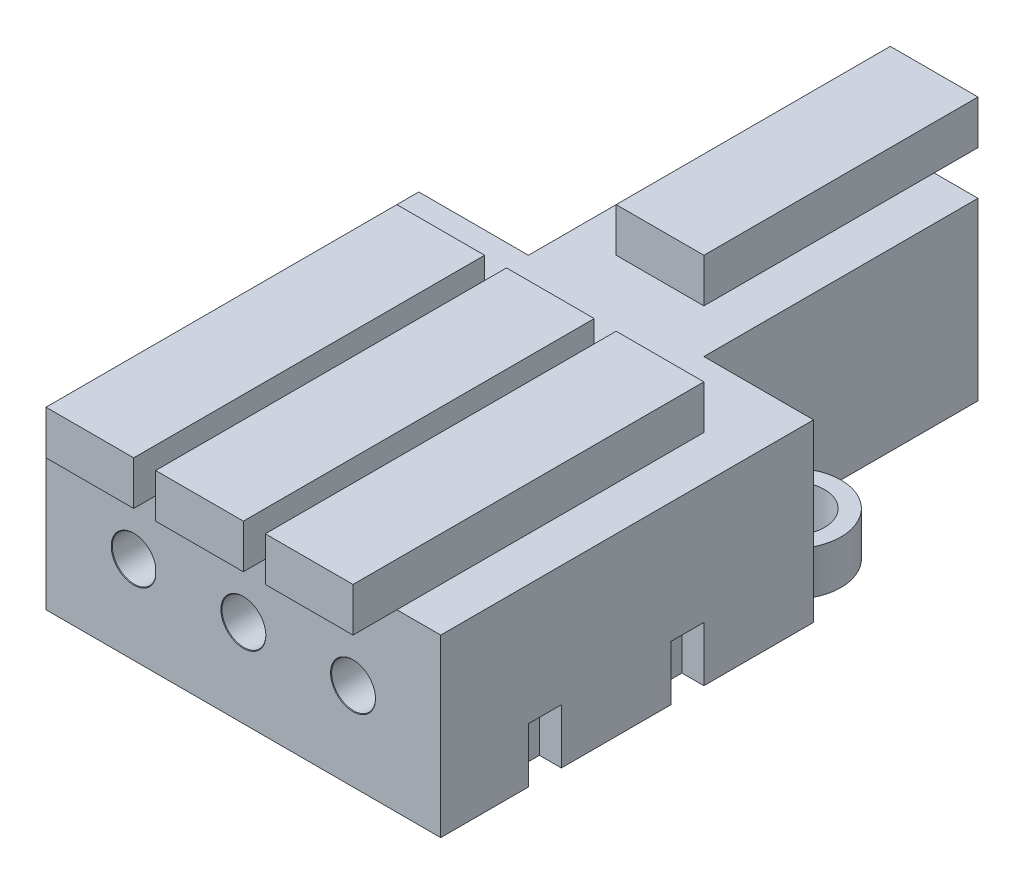
from build123d import *

# Parameters (mm, degrees)
SKETCH1_W                  = 8
SKETCH1_H                  = 17
CONNECTOR_BODY_DEPTH       = 8
SKETCH4_W                  = 4
SKETCH4_H                  = 16
CLAMP_DEPTH                = 2
CONNECTOR_PATTERN_COUNT    = 3
CONNECTOR_PATTERN_PITCH    = 5
SKETCH5_W                  = 8
SKETCH5_H                  = 12.5
SINGLE_BODY_DEPTH          = 8
SKETCH6_W                  = 1.5
SKETCH6_H                  = 2.500390225
CHAINING_NOBS_DEPTH        = 1
SKETCH7_W                  = 1
SKETCH7_H                  = 1.5
CHAINING_NOBS_CUTOUT_DEPTH = 2.50039
SKETCH8_W                  = 4
SKETCH8_H                  = 12.5
SINGLE_BODY_CLAMP_DEPTH    = 2
SKETCH9_R                  = 2.25
SKETCH9_R_2                = 1.5
MOUNTING_RINGS_DEPTH       = 2


with BuildPart() as part:
    # Sketch1 → connector_body (new body)
    with BuildSketch(Plane(origin=(0, 0, 0), x_dir=(1, 0, 0), z_dir=(0, 1, 0))):
        with Locations((4, 8.5)):
            Rectangle(SKETCH1_W, SKETCH1_H)
    connector_body = extrude(amount=CONNECTOR_BODY_DEPTH)

    # Sketch3 → cable_hole (revolve, cut)
    with BuildSketch(Plane(origin=(4, 4, 0), x_dir=(0, -1, 0), z_dir=(1, 0, 0))):
        Polygon((0, 0), (0, 10.600860619), (1, 10), (1, 0.025), (1.025, 0), align=None)
    cable_hole = revolve(axis=Axis((4, 4, 6.35), (0, 0, -1)), mode=Mode.SUBTRACT)

    # Sketch4 → clamp (add)
    with BuildSketch(Plane(origin=(0, 8, 0), x_dir=(1, 0, 0), z_dir=(0, 1, 0))):
        with Locations((4, 6)):
            Rectangle(SKETCH4_W, SKETCH4_H)
    clamp = extrude(amount=CLAMP_DEPTH)

    # connector_pattern: connector_body, cable_hole, clamp ×3
    with Locations(*[(i * CONNECTOR_PATTERN_PITCH, 0, 0) for i in range(1, CONNECTOR_PATTERN_COUNT)]):
        add(connector_body)
        add(cable_hole, mode=Mode.SUBTRACT)
        add(clamp)

    # Sketch5 → single_body (add)
    with BuildSketch(Plane(origin=(0, 8, 0), x_dir=(1, 0, 0), z_dir=(0, 1, 0))):
        with Locations((9, 23.25)):
            Rectangle(SKETCH5_W, SKETCH5_H)
    extrude(amount=-SINGLE_BODY_DEPTH)

    # Sketch6 → chaining_nobs (add)
    with BuildSketch(Plane.ZY):
        with Locations((-11.25, 1.250195113)):
            Rectangle(SKETCH6_W, SKETCH6_H)
        with Locations((-4.75, 1.250195113)):
            Rectangle(SKETCH6_W, SKETCH6_H)
    extrude(amount=CHAINING_NOBS_DEPTH)

    # Sketch7 → chaining_nobs_cutout (cut)
    with BuildSketch(Plane.XZ):
        with Locations((17.5, -4.75)):
            Rectangle(SKETCH7_W, SKETCH7_H)
        with Locations((17.5, -11.25)):
            Rectangle(SKETCH7_W, SKETCH7_H)
    extrude(amount=-CHAINING_NOBS_CUTOUT_DEPTH, mode=Mode.SUBTRACT)

    # Sketch8 → single_body_clamp (add)
    with BuildSketch(Plane(origin=(0, 8, 0), x_dir=(1, 0, 0), z_dir=(0, 1, 0))):
        with Locations((9, 25.25)):
            Rectangle(SKETCH8_W, SKETCH8_H)
    extrude(amount=SINGLE_BODY_CLAMP_DEPTH)

    # Sketch9 → mounting_rings (add)
    # profile 1 of 2: a face of its own
    with BuildSketch(Plane.XZ):
        with Locations((3, -19)):
            Circle(SKETCH9_R)
        with Locations(Location((3, -19, 0), (0, 0, 270))):
            Circle(SKETCH9_R_2, mode=Mode.SUBTRACT)
    # profile 2 of 2: a face of its own
    with BuildSketch(Plane.XZ):
        with Locations((15, -19)):
            Circle(SKETCH9_R)
        with Locations(Location((15, -19, 0), (0, 0, 270))):
            Circle(SKETCH9_R_2, mode=Mode.SUBTRACT)
    extrude(amount=-MOUNTING_RINGS_DEPTH)


solid = part.part
